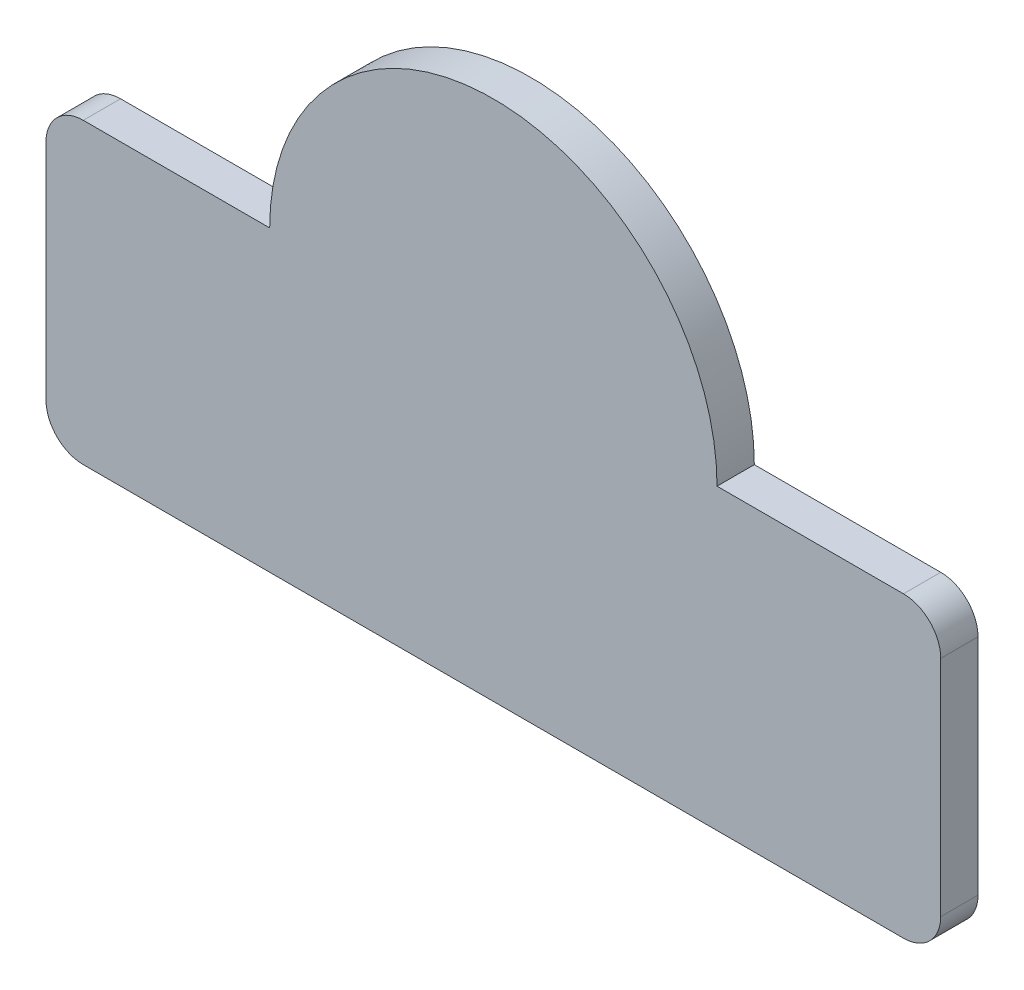
from build123d import *

# Parameters (mm, degrees)
BOSS_EXTRUDE3_DEPTH = 3.175
FILLET1_R           = 3.175


with BuildPart() as part:
    # Sketch1 → Boss-Extrude3 (new body)
    with BuildSketch(Plane.XY):
        with BuildLine():
            Line((35.78531497, 16.139458277), (54.83531497, 16.139458277))
            Line((54.83531497, 16.139458277), (54.83531497, -9.260541723))
            Line((54.83531497, -9.260541723), (-21.36468503, -9.260541723))
            Line((-21.36468503, -9.260541723), (-21.36468503, 16.139458277))
            Line((-21.36468503, 16.139458277), (-2.31468503, 16.139458277))
            ThreePointArc((-2.31468503, 16.139458277), (16.73531497, 35.189458277), (35.78531497, 16.139458277))
        make_face()
    extrude(amount=BOSS_EXTRUDE3_DEPTH)

    # Fillet1
    fillet1_edges = [part.edges().sort_by_distance(p)[0] for p in [
        (54.83531497, 16.139458277, 1.5875),
        (54.83531497, -9.260541723, 1.5875),
        (-21.36468503, -9.260541723, 1.5875),
        (-21.36468503, 16.139458277, 1.5875),
    ]]
    fillet(fillet1_edges, radius=FILLET1_R)


solid = part.part
